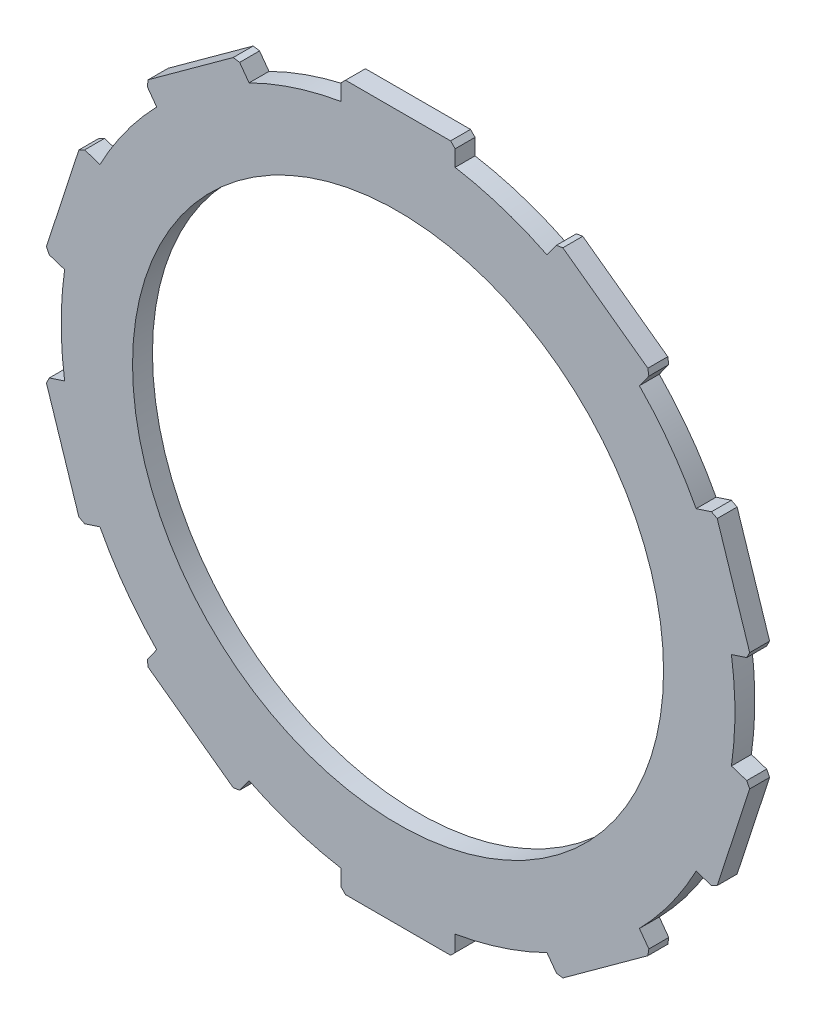
from build123d import *

# Parameters (mm, degrees)
BOSS_EXTRUDE1_DEPTH = 3
SKETCH1_R           = 40
CUT_EXTRUDE1_DEPTH  = 76.086906122


with BuildPart() as part:
    # Base_Sketch → Boss-Extrude1 (new body)
    with BuildSketch(Plane.XY):
        with BuildLine():
            Line((-8.603981625, 52.439957176), (-8.603981625, 50.01533765))
            ThreePointArc((-8.603981625, 50.01533765), (-15.682612465, 48.266118202), (-22.437510505, 45.520551648))
            Line((-22.437510505, 45.520551648), (-23.862666105, 47.48211005))
            Line((-23.862666105, 47.48211005), (-24.825537526, 47.634613901))
            Line((-24.825537526, 47.634613901), (-37.631696962, 38.33039445))
            Line((-37.631696962, 38.33039445), (-37.784200813, 37.36752303))
            Line((-37.784200813, 37.36752303), (-36.359045213, 35.405964628))
            ThreePointArc((-36.359045213, 35.405964628), (-41.057612465, 29.830101554), (-44.908636245, 23.638462104))
            Line((-44.908636245, 23.638462104), (-47.214586445, 24.387710742))
            Line((-47.214586445, 24.387710742), (-48.083205302, 23.945127328))
            Line((-48.083205302, 23.945127328), (-52.974722942, 8.890584019))
            Line((-52.974722942, 8.890584019), (-52.532139528, 8.021965161))
            Line((-52.532139528, 8.021965161), (-50.226189328, 7.272716523))
            ThreePointArc((-50.226189328, 7.272716523), (-50.75, 0), (-50.226189328, -7.272716523))
            Line((-50.226189328, -7.272716523), (-52.532139528, -8.021965161))
            Line((-52.532139528, -8.021965161), (-52.974722942, -8.890584019))
            Line((-52.974722942, -8.890584019), (-48.083205302, -23.945127328))
            Line((-48.083205302, -23.945127328), (-47.214586445, -24.387710742))
            Line((-47.214586445, -24.387710742), (-44.908636245, -23.638462104))
            ThreePointArc((-44.908636245, -23.638462104), (-41.057612465, -29.830101554), (-36.359045213, -35.405964628))
            Line((-36.359045213, -35.405964628), (-37.784200813, -37.36752303))
            Line((-37.784200813, -37.36752303), (-37.631696962, -38.33039445))
            Line((-37.631696962, -38.33039445), (-24.825537526, -47.634613901))
            Line((-24.825537526, -47.634613901), (-23.862666105, -47.48211005))
            Line((-23.862666105, -47.48211005), (-22.437510505, -45.520551648))
            ThreePointArc((-22.437510505, -45.520551648), (-15.682612465, -48.266118202), (-8.603981625, -50.01533765))
            Line((-8.603981625, -50.01533765), (-8.603981625, -52.439957176))
            Line((-8.603981625, -52.439957176), (-7.914641797, -53.129297004))
            Line((-7.914641797, -53.129297004), (7.914641797, -53.129297004))
            Line((7.914641797, -53.129297004), (8.603981625, -52.439957176))
            Line((8.603981625, -52.439957176), (8.603981625, -50.01533765))
            ThreePointArc((8.603981625, -50.01533765), (15.682612465, -48.266118202), (22.437510505, -45.520551648))
            Line((22.437510505, -45.520551648), (23.862666105, -47.48211005))
            Line((23.862666105, -47.48211005), (24.825537526, -47.634613901))
            Line((24.825537526, -47.634613901), (37.631696962, -38.33039445))
            Line((37.631696962, -38.33039445), (37.784200813, -37.36752303))
            Line((37.784200813, -37.36752303), (36.359045213, -35.405964628))
            ThreePointArc((36.359045213, -35.405964628), (41.057612465, -29.830101554), (44.908636245, -23.638462104))
            Line((44.908636245, -23.638462104), (47.214586445, -24.387710742))
            Line((47.214586445, -24.387710742), (48.083205302, -23.945127328))
            Line((48.083205302, -23.945127328), (52.974722942, -8.890584019))
            Line((52.974722942, -8.890584019), (52.532139528, -8.021965161))
            Line((52.532139528, -8.021965161), (50.226189328, -7.272716523))
            ThreePointArc((50.226189328, -7.272716523), (50.75, 0), (50.226189328, 7.272716523))
            Line((50.226189328, 7.272716523), (52.532139528, 8.021965161))
            Line((52.532139528, 8.021965161), (52.974722942, 8.890584019))
            Line((52.974722942, 8.890584019), (48.083205302, 23.945127328))
            Line((48.083205302, 23.945127328), (47.214586445, 24.387710742))
            Line((47.214586445, 24.387710742), (44.908636245, 23.638462104))
            ThreePointArc((44.908636245, 23.638462104), (41.057612465, 29.830101554), (36.359045213, 35.405964628))
            Line((36.359045213, 35.405964628), (37.784200813, 37.36752303))
            Line((37.784200813, 37.36752303), (37.631696962, 38.33039445))
            Line((37.631696962, 38.33039445), (24.825537526, 47.634613901))
            Line((24.825537526, 47.634613901), (23.862666105, 47.48211005))
            Line((23.862666105, 47.48211005), (22.437510505, 45.520551648))
            ThreePointArc((22.437510505, 45.520551648), (15.682612465, 48.266118202), (8.603981625, 50.01533765))
            Line((8.603981625, 50.01533765), (8.603981625, 52.439957176))
            Line((8.603981625, 52.439957176), (7.914641797, 53.129297004))
            Line((7.914641797, 53.129297004), (-7.914641797, 53.129297004))
            Line((-7.914641797, 53.129297004), (-8.603981625, 52.439957176))
        make_face()
    extrude(amount=BOSS_EXTRUDE1_DEPTH)

    # Sketch1 → Cut-Extrude1 (cut, through all)
    with BuildSketch(Plane(origin=(0, 0, 0), x_dir=(-1, 0, 0), z_dir=(0, 0, -1))):
        Circle(SKETCH1_R)
    extrude(amount=-CUT_EXTRUDE1_DEPTH, mode=Mode.SUBTRACT)


solid = part.part
